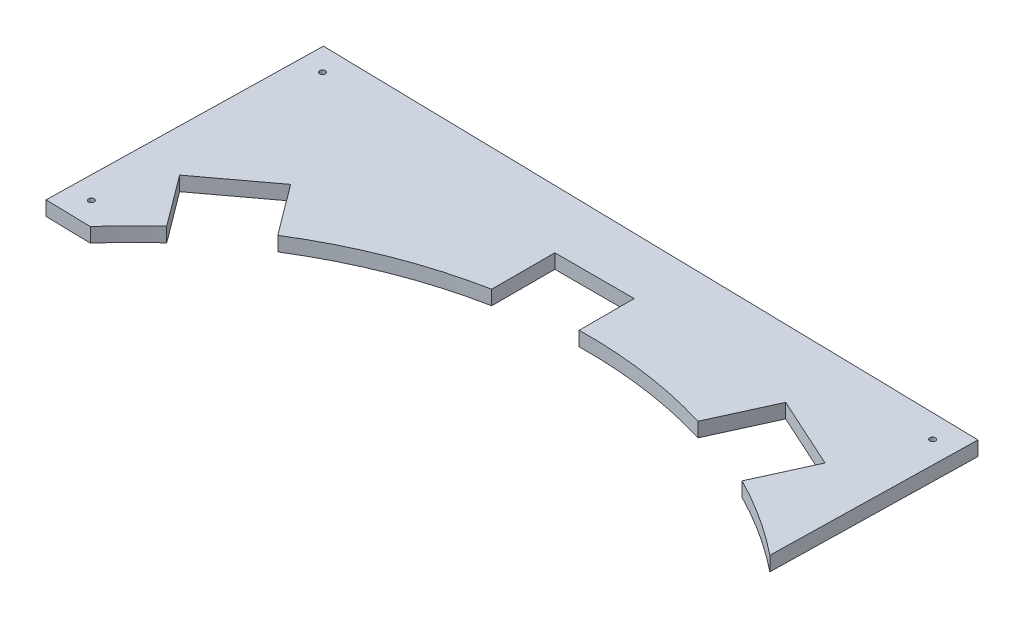
from build123d import *

# Parameters (mm, degrees)
SKETCH1_R           = 1.25
BOSS_EXTRUDE1_DEPTH = 6.35


with BuildPart() as part:
    # Sketch1 → Boss-Extrude1 (new body)
    with BuildSketch(Plane(origin=(0, 0, 0), x_dir=(1, 0, 0), z_dir=(0, 1, 0))):
        with BuildLine():
            Line((-12.884325045, 57.589892951), (-32.880086413, 58.0016299))
            Line((-32.880086413, 58.0016299), (-30.409664718, 177.976198108))
            Line((-30.409664718, 177.976198108), (264.52781546, 171.903078107))
            Line((264.52781546, 171.903078107), (262.674606435, 81.903078107))
            ThreePointArc((262.674606435, 81.903078107), (245.966301841, 93.936578204), (228.109303454, 104.188415872))
            Line((228.109303454, 104.188415872), (239.565645069, 129.341286502))
            Line((239.565645069, 129.341286502), (207.713903894, 143.848752998))
            Line((207.713903894, 143.848752998), (195.598020496, 117.247831174))
            ThreePointArc((195.598020496, 117.247831174), (165.438476431, 123.896281605), (134.614931972, 125.822183564))
            Line((134.614931972, 125.822183564), (134.614931972, 150.073013143))
            Line((134.614931972, 150.073013143), (99.614931972, 150.073013143))
            Line((99.614931972, 150.073013143), (99.614931972, 122.205605467))
            ThreePointArc((99.614931972, 122.205605467), (64.494604203, 112.00765114), (31.818351454, 95.585160423))
            Line((31.818351454, 95.585160423), (15.189825734, 117.890629233))
            Line((15.189825734, 117.890629233), (-12.870789642, 96.971693679))
            Line((-12.870789642, 96.971693679), (3.847059798, 74.546406222))
            ThreePointArc((3.847059798, 74.546406222), (-4.771312567, 66.317474746), (-12.884325045, 57.589892951))
        make_face()
        with Locations(Location((-20.617652508, 167.77244895, 0), (0, 0, 270))):
            Circle(SKETCH1_R, mode=Mode.SUBTRACT)
        with Locations(Location((254.324066301, 162.111065898, 0), (0, 0, 270))):
            Circle(SKETCH1_R, mode=Mode.SUBTRACT)
        with Locations(Location((-22.676337254, 67.79364211, 0), (0, 0, 270))):
            Circle(SKETCH1_R, mode=Mode.SUBTRACT)
    extrude(amount=BOSS_EXTRUDE1_DEPTH)


solid = part.part
